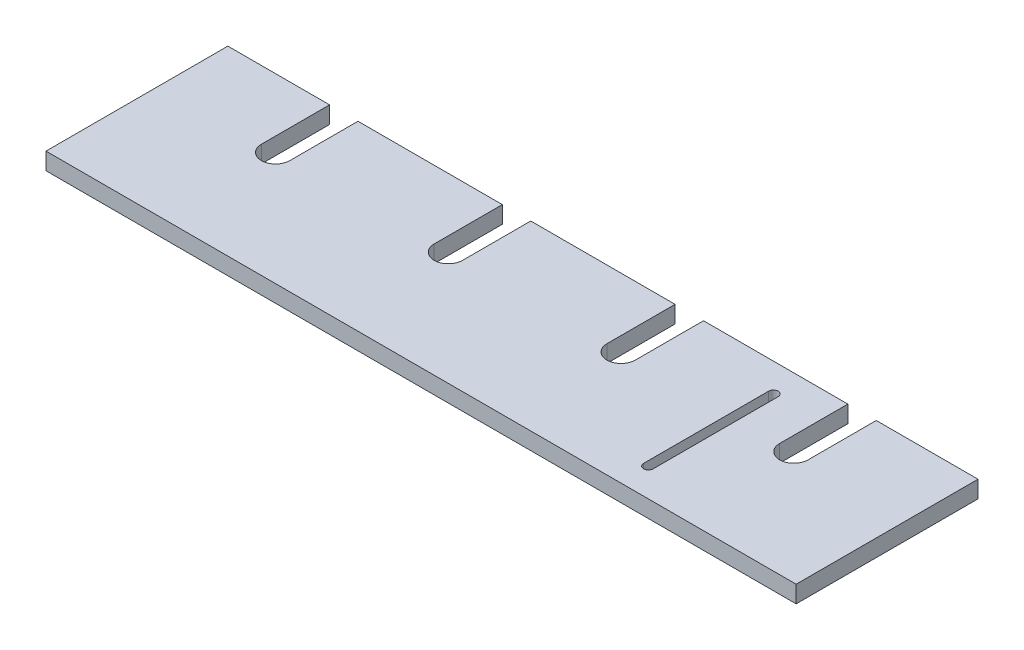
from build123d import *

# Parameters (mm, degrees)
SKETCH50_W          = 419.1
SKETCH50_H          = 101.6
BOSS_EXTRUDE4_DEPTH = 9.525
CUT_EXTRUDE7_REACH  = 217.83
CUT_EXTRUDE8_REACH  = 217.83


with BuildPart() as part:
    # Sketch50 → Boss-Extrude4 (new body)
    with BuildSketch(Plane(origin=(0, 0, 0), x_dir=(1, 0, 0), z_dir=(0, 1, 0))):
        Rectangle(SKETCH50_W, SKETCH50_H)
    extrude(amount=BOSS_EXTRUDE4_DEPTH)

    # Sketch51 → Cut-Extrude7 (cut, up to next)
    with BuildSketch(Plane.XZ, mode=Mode.PRIVATE) as cut_extrude7_sk1:
        with BuildLine():
            Line((152.7175, -12.7), (152.7175, -50.8))
            ThreePointArc((152.7175, -50.8), (144.78, -58.7375), (136.8425, -50.8))
            Line((136.8425, -50.8), (136.8425, -12.7))
            ThreePointArc((136.8425, -12.7), (144.78, -4.7625), (152.7175, -12.7))
        make_face()
    cut_extrude7_tool1 = extrude(cut_extrude7_sk1.sketch, amount=-CUT_EXTRUDE7_REACH, mode=Mode.PRIVATE) & part.part
    # Sketch51 → Cut-Extrude7 (cut, up to next)
    with BuildSketch(Plane.XZ, mode=Mode.PRIVATE) as cut_extrude7_sk2:
        with BuildLine():
            Line((40.3225, -50.8), (40.3225, -12.7))
            ThreePointArc((40.3225, -12.7), (48.26, -4.7625), (56.1975, -12.7))
            Line((56.1975, -12.7), (56.1975, -50.8))
            ThreePointArc((56.1975, -50.8), (48.26, -58.7375), (40.3225, -50.8))
        make_face()
    cut_extrude7_tool2 = extrude(cut_extrude7_sk2.sketch, amount=-CUT_EXTRUDE7_REACH, mode=Mode.PRIVATE) & part.part
    cut_extrude7_1 = cut_extrude7_tool1.solids().sort_by_distance((144.78, 0, -31.75))[0]
    add(cut_extrude7_1, mode=Mode.SUBTRACT)
    cut_extrude7_2 = cut_extrude7_tool2.solids().sort_by_distance((48.26, 0, -31.75))[0]
    add(cut_extrude7_2, mode=Mode.SUBTRACT)
    cut_extrude7 = cut_extrude7_1 + cut_extrude7_2  # Cut-Extrude7 as one shape, for the pattern or mirror that repeats it

    # Mirror4: Cut-Extrude7 across plane
    add(cut_extrude7.mirror(Plane(origin=(0, 0, 0), x_dir=(0, 0, 1), z_dir=(1, 0, 0))), mode=Mode.SUBTRACT)

    # Sketch55 → Cut-Extrude8 (cut, up to next)
    with BuildSketch(Plane.XZ, mode=Mode.PRIVATE) as cut_extrude8_sk1:
        with BuildLine():
            Line((113.792, 34.925), (113.792, -34.925))
            ThreePointArc((113.792, -34.925), (111.125, -37.592), (108.458, -34.925))
            Line((108.458, -34.925), (108.458, 34.925))
            ThreePointArc((108.458, 34.925), (111.125, 37.592), (113.792, 34.925))
        make_face()
    cut_extrude8_tool1 = extrude(cut_extrude8_sk1.sketch, amount=-CUT_EXTRUDE8_REACH, mode=Mode.PRIVATE) & part.part
    add(cut_extrude8_tool1.solids().sort_by_distance((111.125, 0, 0))[0], mode=Mode.SUBTRACT)


solid = part.part
